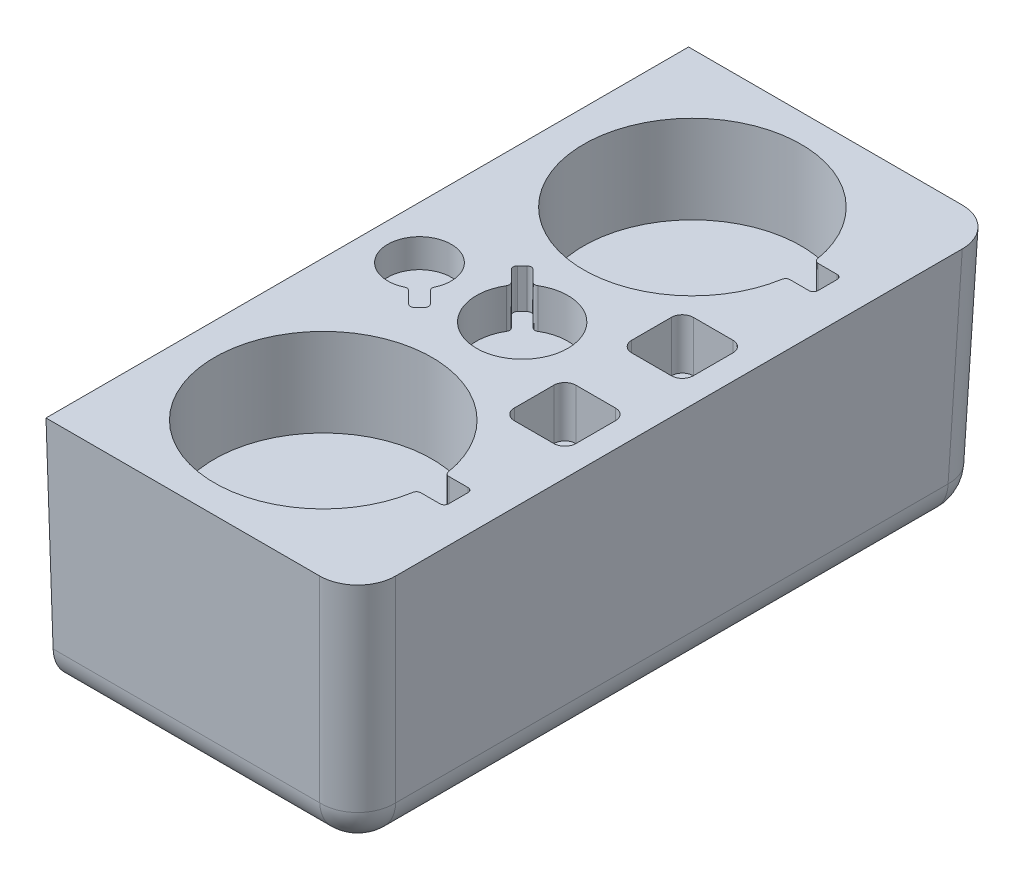
from build123d import *

# Parameters (mm, degrees)
SKETCH3_W               = 137.89
SKETCH3_H               = 284.48
BOSS_EXTRUDE1_DEPTH     = 109.22
BOSS_EXTRUDE1_DRAFT     = -2
FILLET1_R               = 17.272
CUT_EXTRUDE1_START      = 109.22
CUT_EXTRUDE1_DEPTH      = 40
CUT_EXTRUDE2_START      = 109.22
CUT_EXTRUDE2_DEPTH      = 13
CUT_EXTRUDE3_START      = 109.22
CUT_EXTRUDE3_DEPTH      = 18
CUT_EXTRUDE5_START      = 109.22
SKETCH1_6_R             = 8.35
CUT_EXTRUDE5_DEPTH      = 23
CUT_EXTRUDE7_START      = 109.22
SKETCH1_7_R             = 8.35
CUT_EXTRUDE7_DEPTH      = 31
FILLET2_R               = 2
CUT_EXTRUDE8_DEPTH      = 197.353435728
CUT_EXTRUDE8_DEPTH_BACK = 197.353435728


with BuildPart() as part:
    # Sketch3 → Boss-Extrude1 (with draft: the straight prism first)
    with BuildSketch(Plane(origin=(0, 0, 0), x_dir=(1, 0, 0), z_dir=(0, 1, 0))):
        Rectangle(SKETCH3_W, SKETCH3_H)
    extrude(amount=BOSS_EXTRUDE1_DEPTH)
    # Boss-Extrude1: the draft: its side faces are tilted about the plane it starts from
    boss_extrude1_sides = [part.faces().sort_by_distance(p)[0] for p in [
        (0, 54.61, 142.24),
        (68.945, 54.61, 0),
        (0, 54.61, -142.24),
        (-68.945, 54.61, 0),
    ]]
    draft(boss_extrude1_sides, Plane(origin=(0, 0, 0), x_dir=(1, 0, 0), z_dir=(0, 1, 0)), BOSS_EXTRUDE1_DRAFT)

    # Fillet1
    fillet1_edges = [part.edges().sort_by_distance(p)[0] for p in [
        (0, 0, 142.24),
        (0, 0, -142.24),
        (68.945, 0, 0),
        (70.852023222, 54.61, 144.147023222),
        (70.852023222, 54.61, -144.147023222),
    ]]
    fillet(fillet1_edges, radius=FILLET1_R)

    # Sketch1 → Cut-Extrude1 (cut)
    with BuildSketch(Plane(origin=(0, 0, 0), x_dir=(1, 0, 0), z_dir=(0, 1, 0)).offset(CUT_EXTRUDE1_START)):
        with BuildLine():
            Line((43.981048837, 90.304046444), (56.381048837, 90.304046444))
            Line((56.381048837, 90.304046444), (56.381048837, 77.504046444))
            Line((56.381048837, 77.504046444), (43.981048837, 77.504046444))
            ThreePointArc((43.981048837, 77.504046444), (-54.503046444, 83.904046444), (43.981048837, 90.304046444))
        make_face()
        with BuildLine():
            Line((43.981048837, -77.504046444), (56.381048837, -77.504046444))
            Line((56.381048837, -77.504046444), (56.381048837, -90.304046444))
            Line((56.381048837, -90.304046444), (43.981048837, -90.304046444))
            ThreePointArc((43.981048837, -90.304046444), (-54.503046444, -83.904046444), (43.981048837, -77.504046444))
        make_face()
    extrude(amount=-CUT_EXTRUDE1_DEPTH, mode=Mode.SUBTRACT)

    # Sketch1<4> → Cut-Extrude2 (cut)
    with BuildSketch(Plane(origin=(0, 0, 0), x_dir=(1, 0, 0), z_dir=(0, 1, 0)).offset(CUT_EXTRUDE2_START)):
        with BuildLine():
            Line((-25.038870367, -15.216738709), (-32.81704496, -7.438564116))
            ThreePointArc((-32.81704496, -7.438564116), (-55.423049532, 10.217692988), (-37.766792428, -12.388311584))
            Line((-37.766792428, -12.388311584), (-29.988617835, -20.166486177))
            Line((-29.988617835, -20.166486177), (-25.038870367, -15.216738709))
        make_face()
    extrude(amount=-CUT_EXTRUDE2_DEPTH, mode=Mode.SUBTRACT)

    # Sketch1<5> → Cut-Extrude3 (cut)
    with BuildSketch(Plane(origin=(0, 0, 0), x_dir=(1, 0, 0), z_dir=(0, 1, 0)).offset(CUT_EXTRUDE3_START)):
        with BuildLine():
            Line((-23.058973173, 19.589272149), (-15.492930614, 12.02322959))
            ThreePointArc((-15.492930614, 12.02322959), (16.187867493, -14.707821049), (-10.543183146, 16.972977058))
            Line((-10.543183146, 16.972977058), (-18.109225705, 24.539019617))
            Line((-18.109225705, 24.539019617), (-23.058973173, 19.589272149))
        make_face()
    extrude(amount=-CUT_EXTRUDE3_DEPTH, mode=Mode.SUBTRACT)

    # Sketch1<6> → Cut-Extrude5 (cut)
    # profile 1 of 2: a face of its own
    with BuildSketch(Plane(origin=(0, 0, 0), x_dir=(1, 0, 0), z_dir=(0, 1, 0)).offset(CUT_EXTRUDE5_START)):
        with BuildLine():
            Line((38.583046444, 12.7), (56.583046444, 12.7))
            ThreePointArc((56.583046444, 12.7), (60.11858035, 14.164466094), (61.583046444, 17.7))
            Line((61.583046444, 17.7), (61.583046444, 35.7))
            ThreePointArc((61.583046444, 35.7), (60.11858035, 39.235533906), (56.583046444, 40.7))
            Line((56.583046444, 40.7), (38.583046444, 40.7))
            ThreePointArc((38.583046444, 40.7), (35.047512538, 39.235533906), (33.583046444, 35.7))
            Line((33.583046444, 35.7), (33.583046444, 17.7))
            ThreePointArc((33.583046444, 17.7), (35.047512538, 14.164466094), (38.583046444, 12.7))
        make_face()
        with Locations(Location((47.583046444, 26.7, 0), (0, 0, 90))):
            Circle(SKETCH1_6_R, mode=Mode.SUBTRACT)
    # profile 2 of 2: a face of its own
    with BuildSketch(Plane(origin=(0, 0, 0), x_dir=(1, 0, 0), z_dir=(0, 1, 0)).offset(CUT_EXTRUDE5_START)):
        with BuildLine():
            Line((38.583046444, -40.7), (56.583046444, -40.7))
            ThreePointArc((56.583046444, -40.7), (60.11858035, -39.235533906), (61.583046444, -35.7))
            Line((61.583046444, -35.7), (61.583046444, -17.7))
            ThreePointArc((61.583046444, -17.7), (60.11858035, -14.164466094), (56.583046444, -12.7))
            Line((56.583046444, -12.7), (38.583046444, -12.7))
            ThreePointArc((38.583046444, -12.7), (35.047512538, -14.164466094), (33.583046444, -17.7))
            Line((33.583046444, -17.7), (33.583046444, -35.7))
            ThreePointArc((33.583046444, -35.7), (35.047512538, -39.235533906), (38.583046444, -40.7))
        make_face()
        with Locations(Location((47.583046444, -26.7, 0), (0, 0, 90))):
            Circle(SKETCH1_6_R, mode=Mode.SUBTRACT)
    extrude(amount=-CUT_EXTRUDE5_DEPTH, mode=Mode.SUBTRACT)

    # Sketch1<7> → Cut-Extrude7 (cut)
    with BuildSketch(Plane(origin=(0, 0, 0), x_dir=(1, 0, 0), z_dir=(0, 1, 0)).offset(CUT_EXTRUDE7_START)):
        with Locations(Location((47.583046444, 26.7, 0), (0, 0, 90))):
            Circle(SKETCH1_7_R)
        with Locations(Location((47.583046444, -26.7, 0), (0, 0, 90))):
            Circle(SKETCH1_7_R)
    extrude(amount=-CUT_EXTRUDE7_DEPTH, mode=Mode.SUBTRACT)

    # Fillet2
    fillet2_edges = [part.edges().sort_by_distance(p)[0] for p in [
        (43.981048837, 89.22, -77.504046444),
        (43.981048837, 89.22, -90.304046444),
        (56.381048837, 89.22, -90.304046444),
        (56.381048837, 89.22, -77.504046444),
        (43.981048837, 89.22, 90.304046444),
        (43.981048837, 89.22, 77.504046444),
        (56.381048837, 89.22, 77.504046444),
        (56.381048837, 89.22, 90.304046444),
        (-25.038870367, 102.72, 15.216738709),
        (-29.988617835, 102.72, 20.166486177),
        (-37.766792428, 102.72, 12.388311584),
        (-32.81704496, 102.72, 7.438564116),
        (-23.058973173, 100.22, -19.589272149),
        (-18.109225705, 100.22, -24.539019617),
        (-10.543183146, 100.22, -16.972977058),
        (-15.492930614, 100.22, -12.02322959),
    ]]
    fillet(fillet2_edges, radius=FILLET2_R)

    # Sketch4 → Cut-Extrude8 (cut, two sides: drawn at the far end of the back side and taken through both)
    with BuildSketch(Plane.XY.offset(-CUT_EXTRUDE8_DEPTH_BACK)):
        Polygon((-68.945, 109.22), (-68.945, 0), (-84.208745504, 109.22), align=None)
    extrude(amount=CUT_EXTRUDE8_DEPTH + CUT_EXTRUDE8_DEPTH_BACK, mode=Mode.SUBTRACT)


solid = part.part
